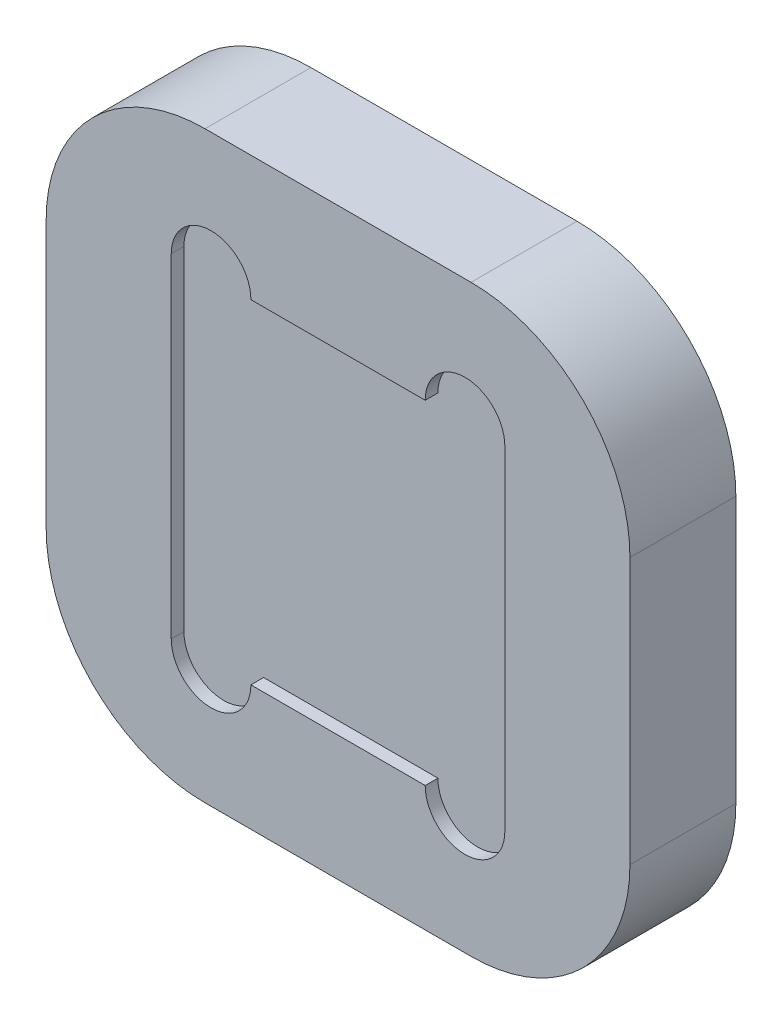
from build123d import *

# Parameters (mm, degrees)
SKETCH1_W           = 35
SKETCH1_H           = 35
BOSS_EXTRUDE1_DEPTH = 6.35
CUT_EXTRUDE1_DEPTH  = 0.762
FILLET1_R           = 9.525


with BuildPart() as part:
    # Sketch1 → Boss-Extrude1 (new body)
    with BuildSketch(Plane.XY):
        Rectangle(SKETCH1_W, SKETCH1_H)
    extrude(amount=BOSS_EXTRUDE1_DEPTH)

    # Sketch3 → Cut-Extrude1 (cut)
    with BuildSketch(Plane.XY.offset(6.35)):
        with BuildLine():
            Line((-10, 10), (-10, -10))
            ThreePointArc((-10, -10), (-7.6124, -12.3876), (-5.2248, -10))
            Line((-5.2248, -10), (5.2248, -10))
            ThreePointArc((5.2248, -10), (7.6124, -12.3876), (10, -10))
            Line((10, -10), (10, 10))
            ThreePointArc((10, 10), (7.6124, 12.3876), (5.2248, 10))
            Line((5.2248, 10), (-5.2248, 10))
            ThreePointArc((-5.2248, 10), (-7.6124, 12.3876), (-10, 10))
        make_face()
    extrude(amount=-CUT_EXTRUDE1_DEPTH, mode=Mode.SUBTRACT)

    # Fillet1
    fillet1_edges = [part.edges().sort_by_distance(p)[0] for p in [
        (17.5, -17.5, 3.175),
        (-17.5, -17.5, 3.175),
        (-17.5, 17.5, 3.175),
        (17.5, 17.5, 3.175),
    ]]
    fillet(fillet1_edges, radius=FILLET1_R)


solid = part.part
